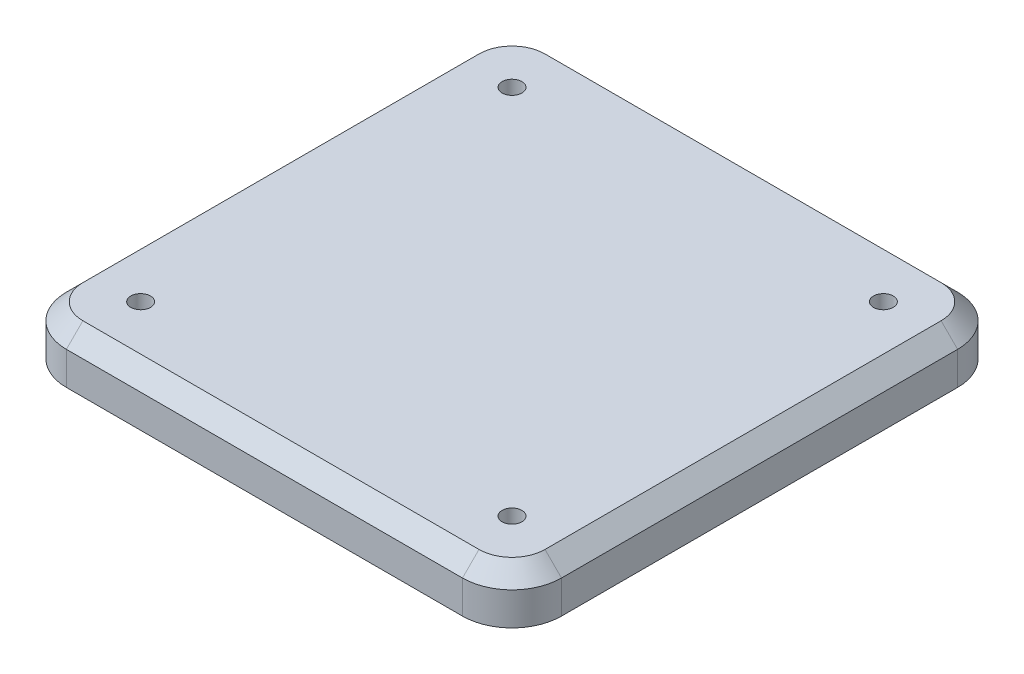
from build123d import *

# Parameters (mm, degrees)
BOSS_EXTRUDE1_DEPTH = 15
CHAMFER1_SIZE       = 10
SKETCH12_R          = 6
CUT_EXTRUDE2_DEPTH  = 10
SKETCH13_R          = 6
CUT_EXTRUDE3_DEPTH  = 10


with BuildPart() as part:
    # Sketch2 → Boss-Extrude1 (new, symmetric)
    with BuildSketch(Plane(origin=(0, 0, 0), x_dir=(1, 0, 0), z_dir=(0, 1, 0))):
        with BuildLine():
            Line((-120, 150), (120, 150))
            ThreePointArc((120, 150), (141.213203436, 141.213203436), (150, 120))
            Line((150, 120), (150, -120))
            ThreePointArc((150, -120), (141.213203436, -141.213203436), (120, -150))
            Line((120, -150), (-120, -150))
            ThreePointArc((-120, -150), (-141.213203436, -141.213203436), (-150, -120))
            Line((-150, -120), (-150, 120))
            ThreePointArc((-150, 120), (-141.213203436, 141.213203436), (-120, 150))
        make_face()
    extrude(amount=BOSS_EXTRUDE1_DEPTH, both=True)

    # Chamfer1
    chamfer1_edges = [part.edges().sort_by_distance(p)[0] for p in [
        (141.213203436, 15, -141.213203436),
        (0, 15, -150),
        (-141.213203436, 15, -141.213203436),
        (-150, 15, 0),
        (-141.213203436, 15, 141.213203436),
        (0, 15, 150),
        (141.213203436, 15, 141.213203436),
        (150, 15, 0),
    ]]
    chamfer(chamfer1_edges, length=CHAMFER1_SIZE)

    # Sketch12 → Cut-Extrude2 (cut)
    with BuildSketch(Plane(origin=(0, 15, 0), x_dir=(1, 0, 0), z_dir=(0, 1, 0))):
        with Locations(Location((-112.5, -112.5, 0), (0, 0, 270))):
            Circle(SKETCH12_R)
        with Locations(Location((112.5, -112.5, 0), (0, 0, 90))):
            Circle(SKETCH12_R)
        with Locations(Location((112.5, 112.5, 0), (0, 0, 270))):
            Circle(SKETCH12_R)
        with Locations(Location((-112.5, 112.5, 0), (0, 0, 90))):
            Circle(SKETCH12_R)
    extrude(amount=-CUT_EXTRUDE2_DEPTH, mode=Mode.SUBTRACT)

    # Sketch13 → Cut-Extrude3 (cut)
    with BuildSketch(Plane.XZ.offset(15)):
        with Locations(Location((125, 125, 0), (0, 0, 270))):
            Circle(SKETCH13_R)
        with Locations(Location((-125, 125, 0), (0, 0, 270))):
            Circle(SKETCH13_R)
        with Locations(Location((125, -125, 0), (0, 0, 270))):
            Circle(SKETCH13_R)
        with Locations(Location((-125, -125, 0), (0, 0, 270))):
            Circle(SKETCH13_R)
    extrude(amount=-CUT_EXTRUDE3_DEPTH, mode=Mode.SUBTRACT)


solid = part.part
